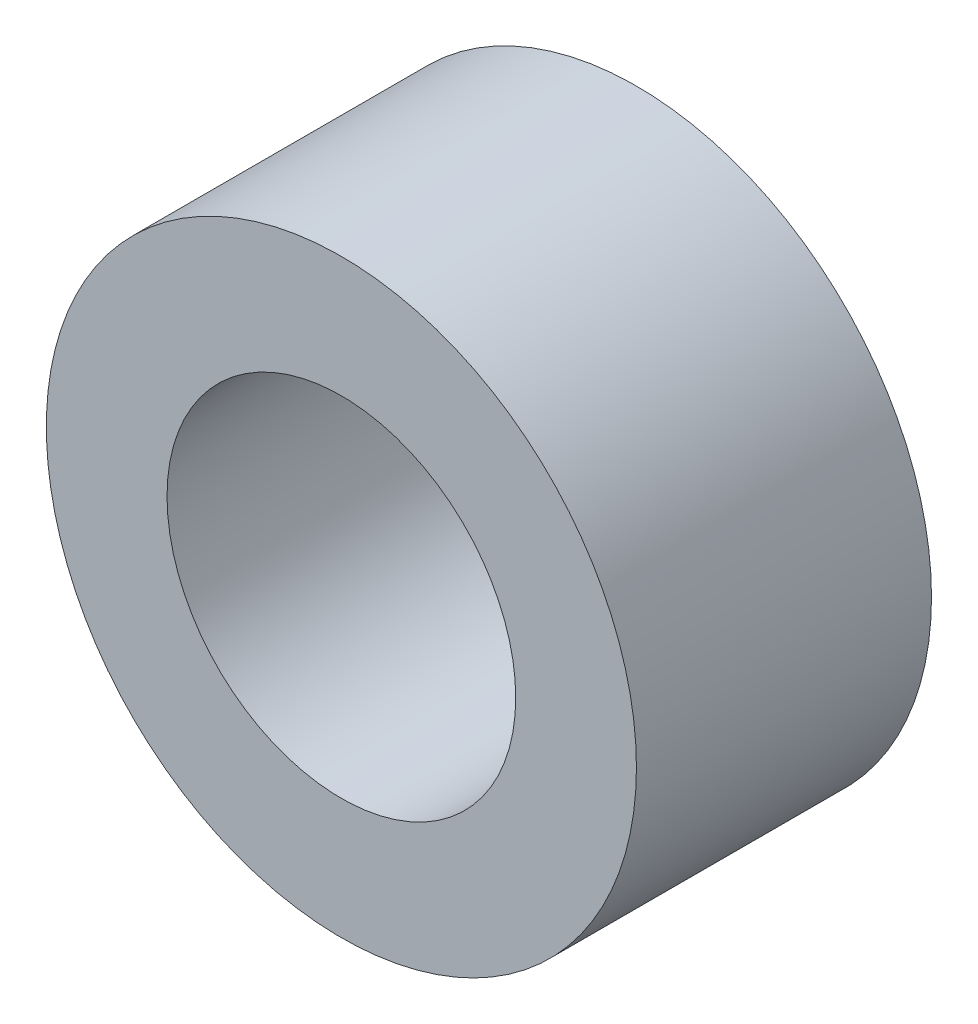
from build123d import *

# Parameters (mm, degrees)
SKETCH_1_R      = 11
SKETCH_1_R_2    = 6.5
EXTRUDE_1_DEPTH = 11


with BuildPart() as part:
    # ｽｹｯﾁ1 → ﾎﾞｽ - 押し出し1 (new body)
    with BuildSketch(Plane.XY):
        Circle(SKETCH_1_R)
        Circle(SKETCH_1_R_2, mode=Mode.SUBTRACT)
    extrude(amount=EXTRUDE_1_DEPTH)


solid = part.part
